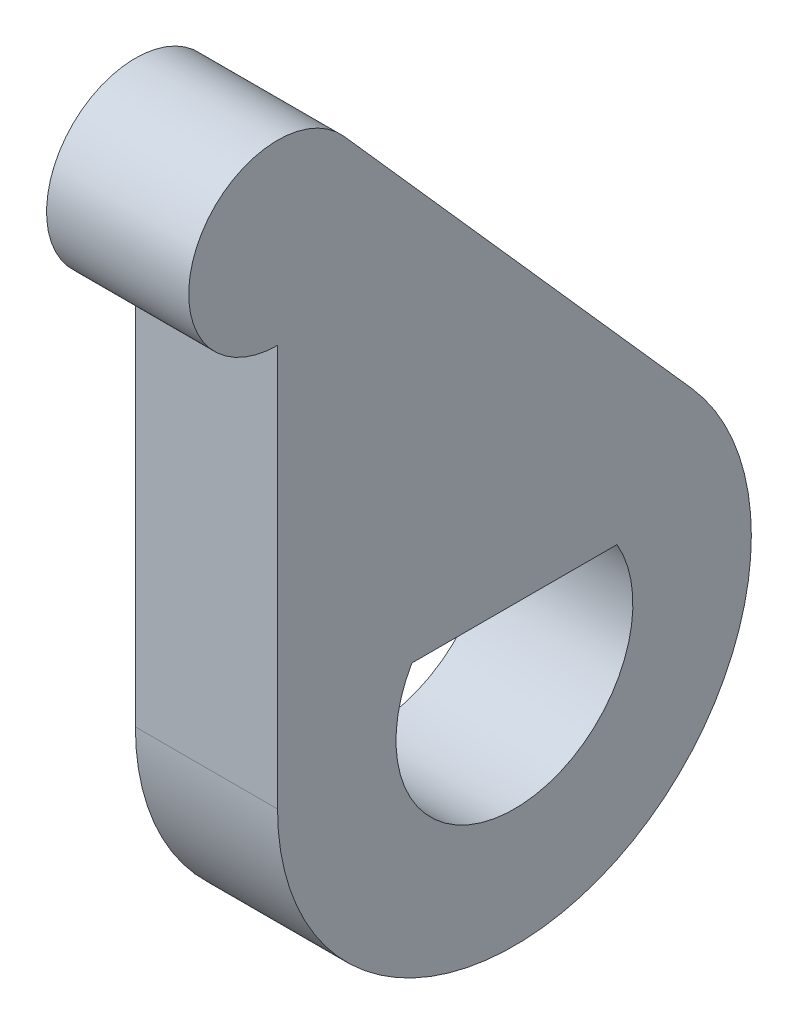
from build123d import *

# Parameters (mm, degrees)
BOSS_EXTRUDE1_DEPTH = 3.81


with BuildPart() as part:
    # Sketch1 → Boss-Extrude1 (new, symmetric)
    with BuildSketch(Plane(origin=(0, 0, 0), x_dir=(0, 0, -1), z_dir=(1, 0, 0))):
        with BuildLine():
            Line((-12.7, 0), (-12.7, 21.524540775))
            ThreePointArc((-12.7, 21.524540775), (-17.043342208, 28.240700088), (-9.136572828, 29.446691553))
            Line((-9.136572828, 29.446691553), (9.502472459, 8.425735408))
            ThreePointArc((9.502472459, 8.425735408), (4.506029281, -11.873739938), (-12.7, 0))
        make_face()
        with BuildLine():
            Line((-5.4991, 3.175279388), (5.4991, 3.175279388))
            ThreePointArc((5.4991, 3.175279388), (0, -6.35), (-5.4991, 3.175279388))
        make_face(mode=Mode.SUBTRACT)
    extrude(amount=BOSS_EXTRUDE1_DEPTH, both=True)


solid = part.part
